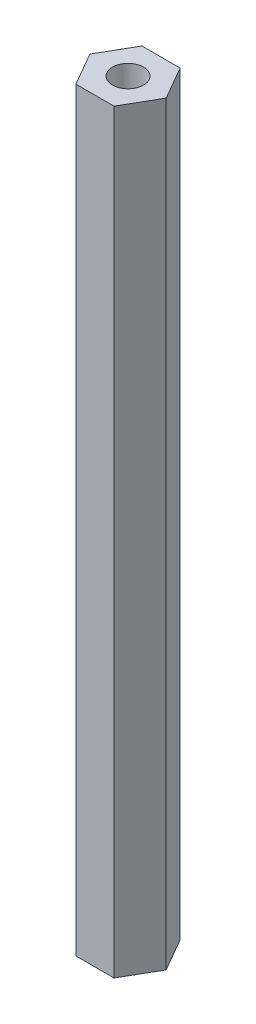
from build123d import *

# Parameters (mm, degrees)
SALIENTE_EXTRUIR1_DEPTH = 40


with BuildPart() as part:
    # Croquis1 → Saliente-Extruir1 (new, symmetric)
    with BuildSketch(Plane(origin=(0, 0, 0), x_dir=(1, 0, 0), z_dir=(0, 1, 0))):
        Polygon((-2.020725942, 3.5), (-4.041451884, 0), (-2.020725942, -3.5), (2.020725942, -3.5), (4.041451884, 0), (2.020725942, 3.5), align=None)
    extrude(amount=SALIENTE_EXTRUIR1_DEPTH, both=True)

    # Croquis4 → Taladro roscado M41 (revolve, cut)
    with BuildSketch(Plane(origin=(0, 40, 0), x_dir=(0, 0, 1), z_dir=(1, 0, 0))):
        Polygon((0, 0), (0, 13.491420021), (1.65, 12.5), (1.65, 0), align=None)
    taladro_roscado_m41 = revolve(axis=Axis((0, 46.35, 0), (0, -1, 0)), mode=Mode.SUBTRACT)

    # Simetría1: Taladro roscado M41 across plane
    add(taladro_roscado_m41.mirror(Plane.ZX), mode=Mode.SUBTRACT)


solid = part.part
